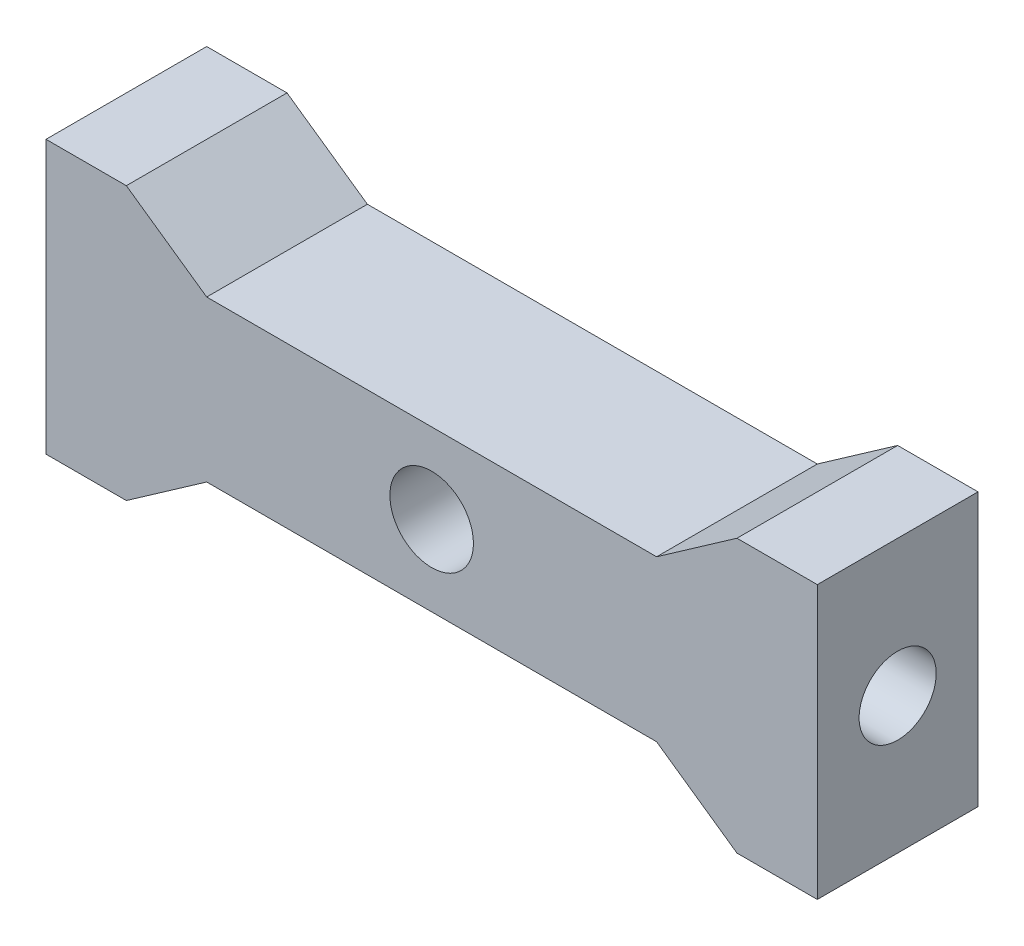
from build123d import *

# Parameters (mm, degrees)
SKETCH_1_W          = 48
SKETCH_1_H          = 16.97
SKETCH_1_R          = 2.6
EXTRUDE_1_DEPTH     = 10
SKETCH_3_R          = 2.4
CUT_EXTRUDE_1_DEPTH = 6
CUT_EXTRUDE_START   = -6
SKETCH_4_R          = 2.4
CUT_EXTRUDE_2_DEPTH = 6
CUT_EXTRUDE_3_DEPTH = 28.349501367


with BuildPart() as part:
    # ｽｹｯﾁ1 → ﾎﾞｽ - 押し出し1 (new body)
    with BuildSketch(Plane.XY):
        Rectangle(SKETCH_1_W, SKETCH_1_H)
        Circle(SKETCH_1_R, mode=Mode.SUBTRACT)
    extrude(amount=EXTRUDE_1_DEPTH)

    # ｽｹｯﾁ3 → ｶｯﾄ - 押し出し1 (cut)
    with BuildSketch(Plane(origin=(24, 0, 0), x_dir=(0, 0, -1), z_dir=(1, 0, 0))):
        with Locations((-5, 0)):
            Circle(SKETCH_3_R)
    extrude(amount=-CUT_EXTRUDE_1_DEPTH, mode=Mode.SUBTRACT)

    # ｽｹｯﾁ4 → ｶｯﾄ - 押し出し2 (cut)
    with BuildSketch(Plane.ZY.offset(24).offset(CUT_EXTRUDE_START)):
        with Locations(Location((5, 0, 0), (0, 0, 180))):
            Circle(SKETCH_4_R)
    extrude(amount=CUT_EXTRUDE_2_DEPTH, mode=Mode.SUBTRACT)

    # ｽｹｯﾁ5 → ｶｯﾄ - 押し出し3 (cut, through all)
    with BuildSketch(Plane.XY.offset(10)):
        Polygon((-14, 4.985), (14, 4.985), (19, 8.485), (-19, 8.485), align=None)
        Polygon((-14, -4.985), (14, -4.985), (19, -8.485), (-19, -8.485), align=None)
    extrude(amount=-CUT_EXTRUDE_3_DEPTH, mode=Mode.SUBTRACT)


solid = part.part
